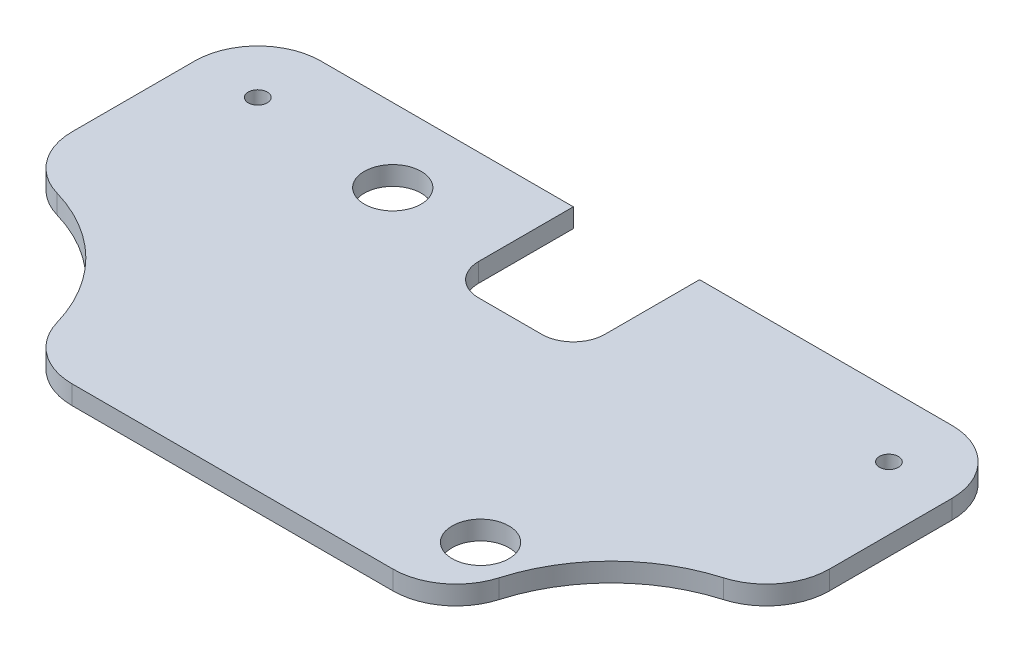
from build123d import *

# Parameters (mm, degrees)
SKETCH_1_W          = 120
SKETCH_1_H          = 64
EXTRUDE_1_DEPTH     = 3
SKETCH_2_R          = 1.5
CUT_EXTRUDE_1_DEPTH = 3
FILLET_1_R          = 10
SKETCH_3_W          = 20
SKETCH_3_H          = 20
CUT_EXTRUDE_2_DEPTH = 3
SKETCH_4_R          = 26
CUT_EXTRUDE_3_DEPTH = 3
FILLET_2_R          = 5
FILLET_3_R          = 10
FILLET_4_R          = 10
SKETCH_6_R          = 2.1
CUT_EXTRUDE_5_DEPTH = 6
SKETCH_7_R          = 4.5
CUT_EXTRUDE_6_DEPTH = 3


with BuildPart() as part:
    # 草图1 → 凸台-拉伸1 (new body)
    with BuildSketch(Plane(origin=(0, 0, 0), x_dir=(1, 0, 0), z_dir=(0, 1, 0))):
        Rectangle(SKETCH_1_W, SKETCH_1_H)
    extrude(amount=EXTRUDE_1_DEPTH)

    # 草图2 → 切除-拉伸1 (cut)
    with BuildSketch(Plane(origin=(0, 3, 0), x_dir=(1, 0, 0), z_dir=(0, 1, 0))):
        with Locations(Location((-50, 22, 0), (0, 0, 270))):
            Circle(SKETCH_2_R)
        with Locations(Location((50, 22, 0), (0, 0, 90))):
            Circle(SKETCH_2_R)
    extrude(amount=-CUT_EXTRUDE_1_DEPTH, mode=Mode.SUBTRACT)

    # 圆角1
    fillet_1_edges = [part.edges().sort_by_distance(p)[0] for p in [
        (-60, 1.5, -32),
        (60, 1.5, -32),
    ]]
    fillet(fillet_1_edges, radius=FILLET_1_R)

    # 草图3 → 切除-拉伸2 (cut)
    with BuildSketch(Plane.XZ):
        with Locations((0, -22)):
            Rectangle(SKETCH_3_W, SKETCH_3_H)
    extrude(amount=-CUT_EXTRUDE_2_DEPTH, mode=Mode.SUBTRACT)

    # 草图4 → 切除-拉伸3 (cut)
    with BuildSketch(Plane.XZ):
        with Locations((-60, 32)):
            Circle(SKETCH_4_R)
        with Locations((60, 32)):
            Circle(SKETCH_4_R)
    extrude(amount=-CUT_EXTRUDE_3_DEPTH, mode=Mode.SUBTRACT)

    # 圆角2
    fillet_2_edges = [part.edges().sort_by_distance(p)[0] for p in [
        (-10, 1.5, -12),
        (10, 1.5, -12),
    ]]
    fillet(fillet_2_edges, radius=FILLET_2_R)

    # 圆角3
    fillet_3_edges = [part.edges().sort_by_distance(p)[0] for p in [
        (-60, 1.5, 6),
        (60, 1.5, 6),
    ]]
    fillet(fillet_3_edges, radius=FILLET_3_R)

    # 圆角4
    fillet_4_edges = [part.edges().sort_by_distance(p)[0] for p in [
        (-34, 1.5, 32),
        (34, 1.5, 32),
    ]]
    fillet(fillet_4_edges, radius=FILLET_4_R)

    # 草图6 → 切除-拉伸5 (cut)
    with BuildSketch(Plane(origin=(0, 6, 189.146349293), x_dir=(0, 0, 1), z_dir=(0, 1, 0))):
        with Locations((-209.45594255, -26.921391455)):
            Circle(SKETCH_6_R)
        with Locations((-167.762204108, 28.683304163)):
            Circle(SKETCH_6_R)
    extrude(amount=-CUT_EXTRUDE_5_DEPTH, mode=Mode.SUBTRACT)

    # 草图7 → 切除-拉伸6 (cut)
    with BuildSketch(Plane.XZ):
        with Locations(Location((-26.921391455, -20.309593257, 0), (0, 0, 270))):
            Circle(SKETCH_7_R)
        with Locations(Location((28.683304163, 21.384145185, 0), (0, 0, 270))):
            Circle(SKETCH_7_R)
    extrude(amount=-CUT_EXTRUDE_6_DEPTH, mode=Mode.SUBTRACT)


solid = part.part
